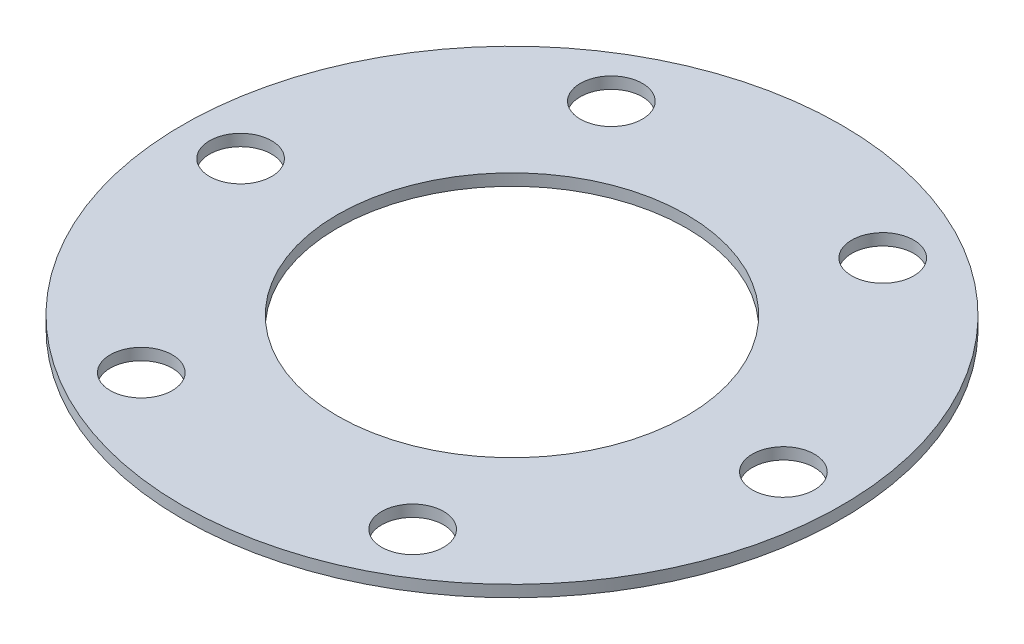
from build123d import *

# Parameters (mm, degrees)
SKETCH1_R               = 85
SKETCH1_R_2             = 45
BOSS_EXTRUDE1_DEPTH     = 1.5
CUT_EXTRUDE1_DEPTH      = 121.245582039
CUT_EXTRUDE1_DEPTH_BACK = 121.245582039
SKETCH2_R               = 8


with BuildPart() as part:
    # Sketch1 → Boss-Extrude1 (new, symmetric)
    with BuildSketch(Plane(origin=(0, 0, 0), x_dir=(1, 0, 0), z_dir=(0, 1, 0))):
        with Locations(Location((0, 0, 0), (0, 0, 270))):
            Circle(SKETCH1_R)
        with Locations(Location((0, 0, 0), (0, 0, 270))):
            Circle(SKETCH1_R_2, mode=Mode.SUBTRACT)
    extrude(amount=BOSS_EXTRUDE1_DEPTH, both=True)

    # Sketch2 → Cut-Extrude1 (cut, two sides: drawn at the far end of the back side and taken through both)
    with BuildSketch(Plane(origin=(0, 1.5, 0), x_dir=(1, 0, 0), z_dir=(0, 1, 0)).offset(-CUT_EXTRUDE1_DEPTH_BACK)):
        with Locations(Location((70, 0, 0), (0, 0, 270))):
            Circle(SKETCH2_R)
        with Locations(Location((35, -60.621778265, 0), (0, 0, 270))):
            Circle(SKETCH2_R)
        with Locations(Location((-35, -60.621778265, 0), (0, 0, 270))):
            Circle(SKETCH2_R)
        with Locations(Location((-70, 0, 0), (0, 0, 270))):
            Circle(SKETCH2_R)
        with Locations(Location((-35, 60.621778265, 0), (0, 0, 270))):
            Circle(SKETCH2_R)
        with Locations(Location((35, 60.621778265, 0), (0, 0, 270))):
            Circle(SKETCH2_R)
    extrude(amount=CUT_EXTRUDE1_DEPTH + CUT_EXTRUDE1_DEPTH_BACK, mode=Mode.SUBTRACT)


solid = part.part
